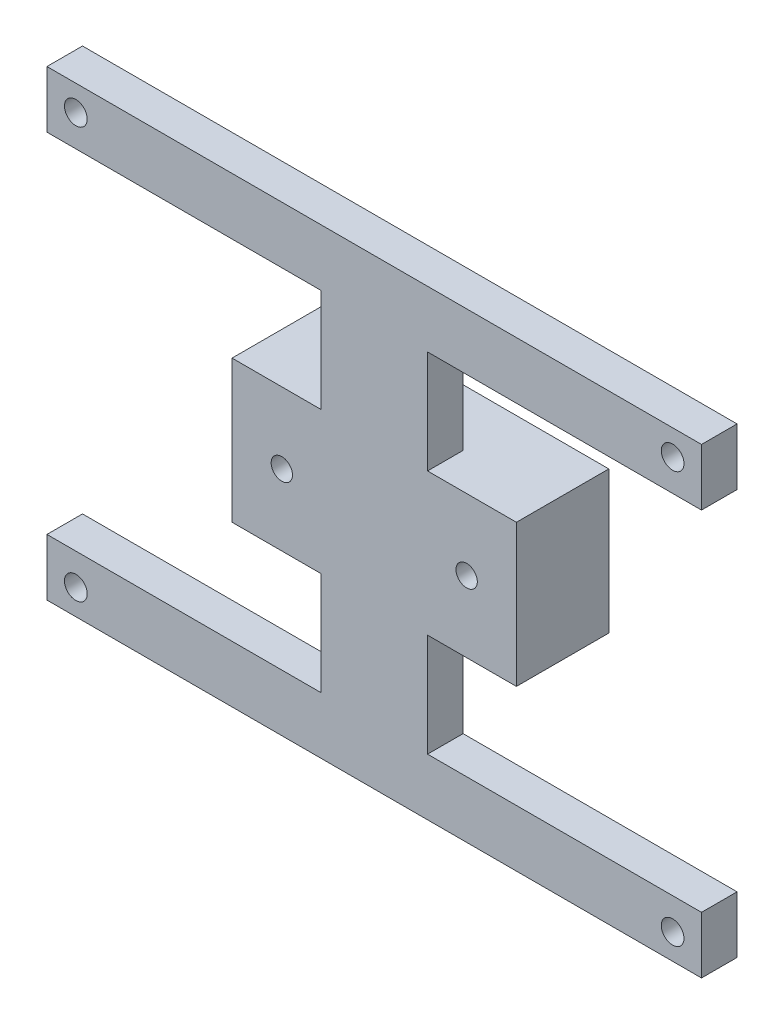
from build123d import *

# Parameters (mm, degrees)
SKETCH_1_W          = 92.075
SKETCH_1_H          = 8
SKETCH_1_R          = 1.6
SKETCH_1_W_2        = 12.5
SKETCH_1_H_2        = 20
SKETCH_1_W_3        = 15
SKETCH_1_H_3        = 14.5
EXTRUDE_1_DEPTH     = 5
SKETCH_2_R          = 1.5
CUT_EXTRUDE_1_DEPTH = 10
SKETCH_4_W          = 40
SKETCH_4_H          = 20
SKETCH_4_R          = 1.5
EXTRUDE_3_DEPTH     = 8


with BuildPart() as part:
    # 草图1 → 凸台-拉伸1 (new body)
    # profile 1 of 7: a face of its own
    with BuildSketch(Plane.XY):
        with Locations((0, 28.5)):
            Rectangle(SKETCH_1_W, SKETCH_1_H)
        with Locations((41.9735, 28.92)):
            Circle(SKETCH_1_R, mode=Mode.SUBTRACT)
        with Locations((-41.9735, 28.92)):
            Circle(SKETCH_1_R, mode=Mode.SUBTRACT)
    # profile 2 of 7: a face of its own
    with BuildSketch(Plane.XY):
        with Locations((13.75, 0)):
            Rectangle(SKETCH_1_W_2, SKETCH_1_H_2)
    # profile 3 of 7: a face of its own
    with BuildSketch(Plane.XY):
        Rectangle(SKETCH_1_W_3, SKETCH_1_H_2)
    # profile 4 of 7: a face of its own
    with BuildSketch(Plane.XY):
        with Locations((-13.75, 0)):
            Rectangle(SKETCH_1_W_2, SKETCH_1_H_2)
    # profile 5 of 7: a face of its own
    with BuildSketch(Plane.XY):
        with Locations((0, 17.25)):
            Rectangle(SKETCH_1_W_3, SKETCH_1_H_3)
    # profile 6 of 7: a face of its own
    with BuildSketch(Plane.XY):
        with Locations((0, -28.5)):
            Rectangle(SKETCH_1_W, SKETCH_1_H)
        with Locations((-41.9735, -28.92)):
            Circle(SKETCH_1_R, mode=Mode.SUBTRACT)
        with Locations((41.9735, -28.92)):
            Circle(SKETCH_1_R, mode=Mode.SUBTRACT)
    # profile 7 of 7: a face of its own
    with BuildSketch(Plane.XY):
        with Locations((0, -17.25)):
            Rectangle(SKETCH_1_W_3, SKETCH_1_H_3)
    extrude(amount=EXTRUDE_1_DEPTH)

    # 草图2 → 切除-拉伸1 (cut)
    with BuildSketch(Plane.XY.offset(5)):
        with Locations((13, 0)):
            Circle(SKETCH_2_R)
        with Locations((-13, 0)):
            Circle(SKETCH_2_R)
    extrude(amount=-CUT_EXTRUDE_1_DEPTH, mode=Mode.SUBTRACT)

    # 草图4 → 凸台-拉伸3 (add)
    with BuildSketch(Plane(origin=(0, 0, 0), x_dir=(-1, 0, 0), z_dir=(0, 0, -1))):
        Rectangle(SKETCH_4_W, SKETCH_4_H)
        with Locations(Location((-13, 0, 0), (0, 0, 180))):
            Circle(SKETCH_4_R, mode=Mode.SUBTRACT)
        with Locations(Location((13, 0, 0), (0, 0, 180))):
            Circle(SKETCH_4_R, mode=Mode.SUBTRACT)
    extrude(amount=EXTRUDE_3_DEPTH)


solid = part.part
